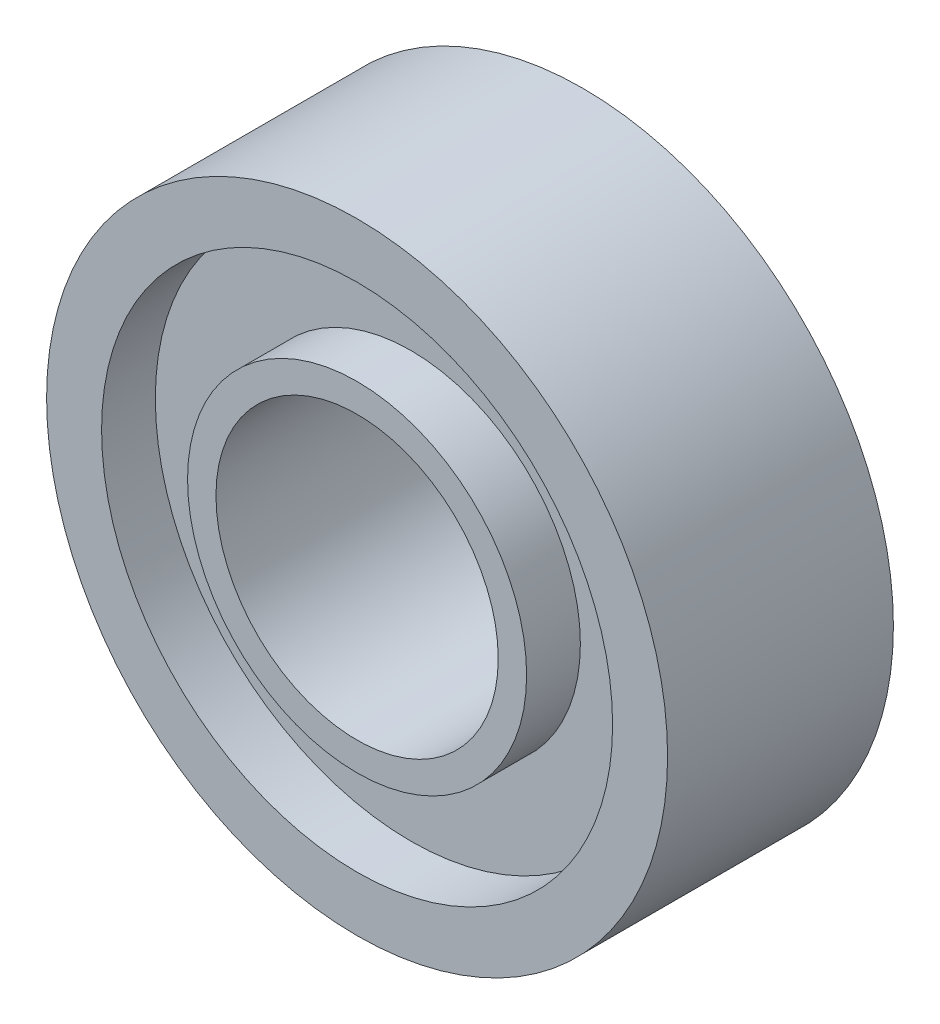
from build123d import *

# Parameters (mm, degrees)
SKETCH1_R           = 5.5
SKETCH1_R_2         = 2.5
BOSS_EXTRUDE1_DEPTH = 2
SKETCH2_R           = 4.526057725
SKETCH2_R_2         = 3.002990226
CUT_EXTRUDE1_DEPTH  = 0.952


with BuildPart() as part:
    # Sketch1 → Boss-Extrude1 (new body)
    with BuildSketch(Plane.XY):
        Circle(SKETCH1_R)
        Circle(SKETCH1_R_2, mode=Mode.SUBTRACT)
    extrude(amount=BOSS_EXTRUDE1_DEPTH)

    # Sketch2 → Cut-Extrude1 (cut)
    with BuildSketch(Plane.XY.offset(2)):
        Circle(SKETCH2_R)
        Circle(SKETCH2_R_2, mode=Mode.SUBTRACT)
    extrude(amount=-CUT_EXTRUDE1_DEPTH, mode=Mode.SUBTRACT)

    # Mirror1: part across plane


with BuildPart() as part_1:
    add(part.part)
    add(part.part.mirror(Plane.XY))


solid = part_1.part
